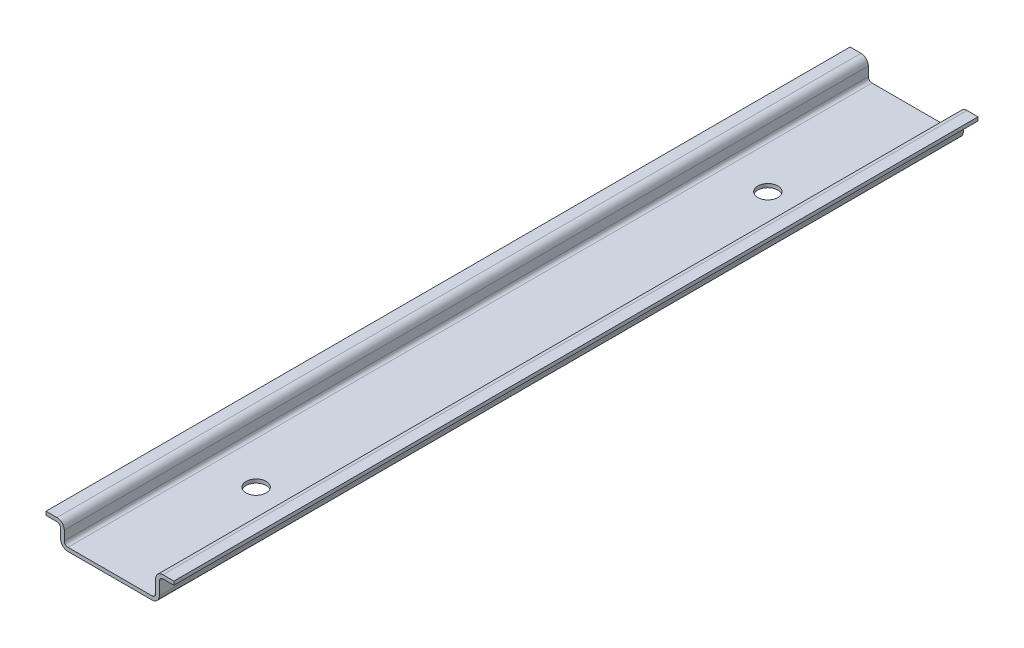
from build123d import *

# Parameters (mm, degrees)
BOSS_EXTRUDE1_DEPTH = 220
SKETCH2_R           = 2.75
CUT_EXTRUDE1_DEPTH  = 1


with BuildPart() as part:
    # Sketch1 → Boss-Extrude1 (new body)
    with BuildSketch(Plane.XY):
        with BuildLine():
            Line((2, 0), (25, 0))
            ThreePointArc((25, 0), (26.414213562, 0.585786438), (27, 2))
            Line((27, 2), (27, 5.5))
            ThreePointArc((27, 5.5), (27.292893219, 6.207106781), (28, 6.5))
            Line((28, 6.5), (31, 6.5))
            Line((31, 6.5), (31, 7.5))
            Line((31, 7.5), (28, 7.5))
            ThreePointArc((28, 7.5), (26.585786438, 6.914213562), (26, 5.5))
            Line((26, 5.5), (26, 2))
            ThreePointArc((26, 2), (25.707106781, 1.292893219), (25, 1))
            Line((25, 1), (2, 1))
            ThreePointArc((2, 1), (1.292893219, 1.292893219), (1, 2))
            Line((1, 2), (1, 4.544540718))
            ThreePointArc((1, 4.544540718), (0.414213562, 5.95875428), (-1, 6.544540718))
            Line((-1, 6.544540718), (-4, 6.544540718))
            Line((-4, 6.544540718), (-4, 5.544540718))
            Line((-4, 5.544540718), (-1, 5.544540718))
            ThreePointArc((-1, 5.544540718), (-0.292893219, 5.251647499), (0, 4.544540718))
            Line((0, 4.544540718), (0, 2))
            ThreePointArc((0, 2), (0.585786438, 0.585786438), (2, 0))
        make_face()
    extrude(amount=BOSS_EXTRUDE1_DEPTH)

    # Sketch2 → Cut-Extrude1 (cut)
    with BuildSketch(Plane(origin=(0, 1, 0), x_dir=(1, 0, 0), z_dir=(0, 1, 0))):
        with Locations(Location((13.5, -40, 0), (0, 0, 270))):
            Circle(SKETCH2_R)
        with Locations(Location((13.5, -180, 0), (0, 0, 270))):
            Circle(SKETCH2_R)
    extrude(amount=-CUT_EXTRUDE1_DEPTH, mode=Mode.SUBTRACT)


solid = part.part
